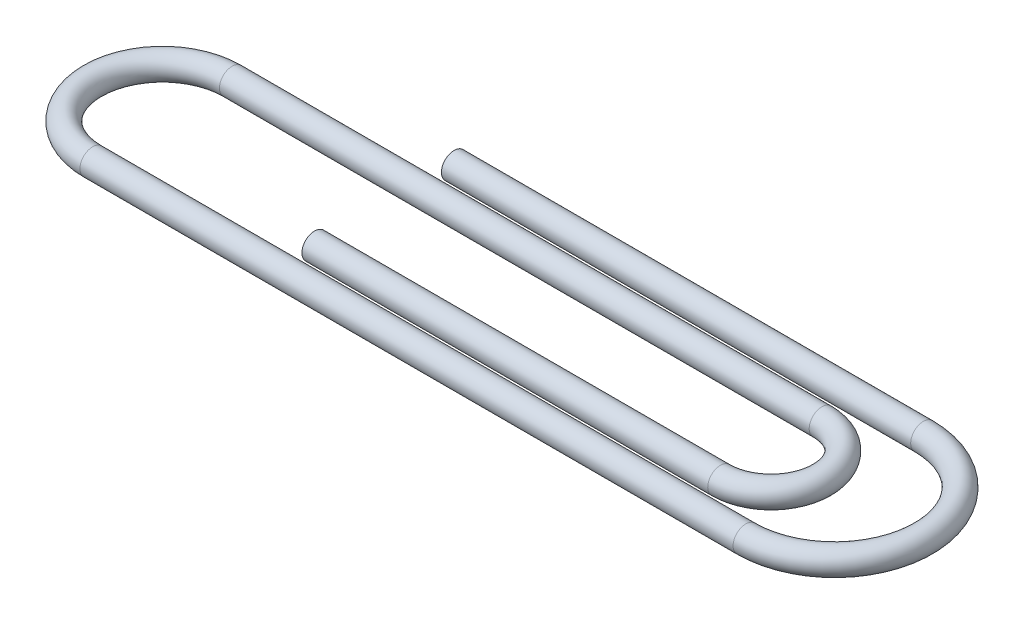
from build123d import *

# Parameters (mm, degrees)
SKETCH1_R = 0.5


with BuildPart() as part:
    # Sweep1: sweep along a path in Sketch3
    with BuildLine(Plane(origin=(0, 0, 0), x_dir=(1, 0, 0), z_dir=(0, 1, 0))) as sweep1_path:
        Line((0, 0), (18.5, 0))
        ThreePointArc((18.5, 0), (22, -3.5), (18.5, -7))
        Line((18.5, -7), (-7.25, -7))
        ThreePointArc((-7.25, -7), (-10, -4.25), (-7.25, -1.5))
        Line((-7.25, -1.5), (16, -1.5))
        ThreePointArc((16, -1.5), (18, -3.5), (16, -5.5))
        Line((16, -5.5), (0, -5.5))
    # Sketch1 → Sweep1 (sweep)
    with BuildSketch(Plane(origin=(0, 0, 0), x_dir=(0, 0, -1), z_dir=(1, 0, 0))):
        Circle(SKETCH1_R)
    sweep(path=sweep1_path.line)


solid = part.part
